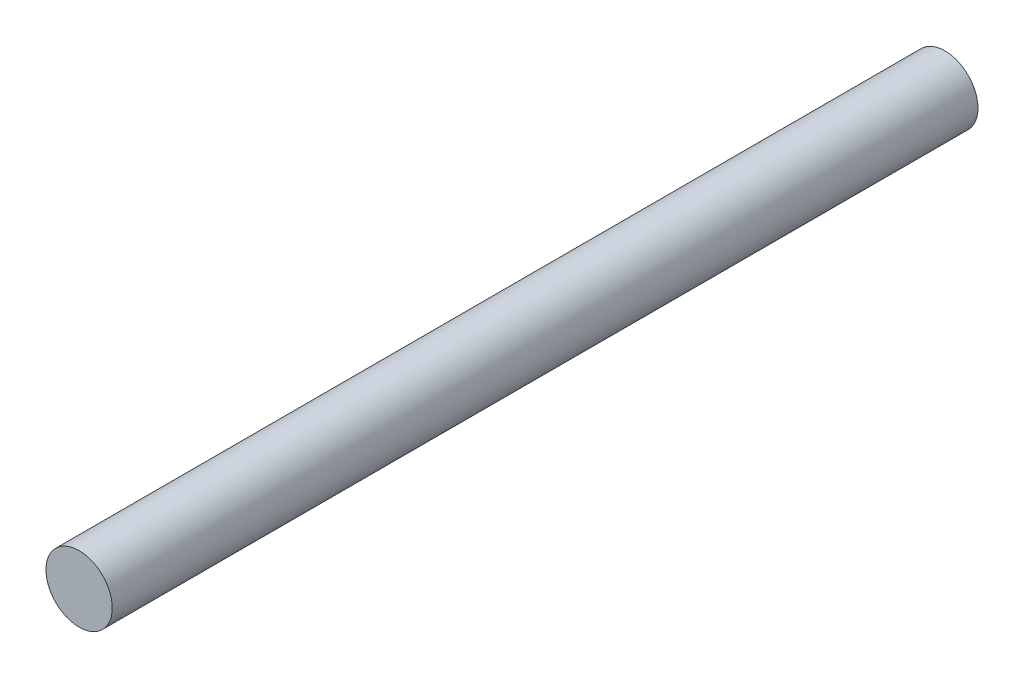
from build123d import *

# Parameters (mm, degrees)
SKETCH1_R           = 1.8
BOSS_EXTRUDE1_DEPTH = 47


with BuildPart() as part:
    # Sketch1 → Boss-Extrude1 (new body)
    with BuildSketch(Plane.XY):
        with Locations((-63.023613914, 18.932496922)):
            Circle(SKETCH1_R)
    extrude(amount=BOSS_EXTRUDE1_DEPTH)


solid = part.part
